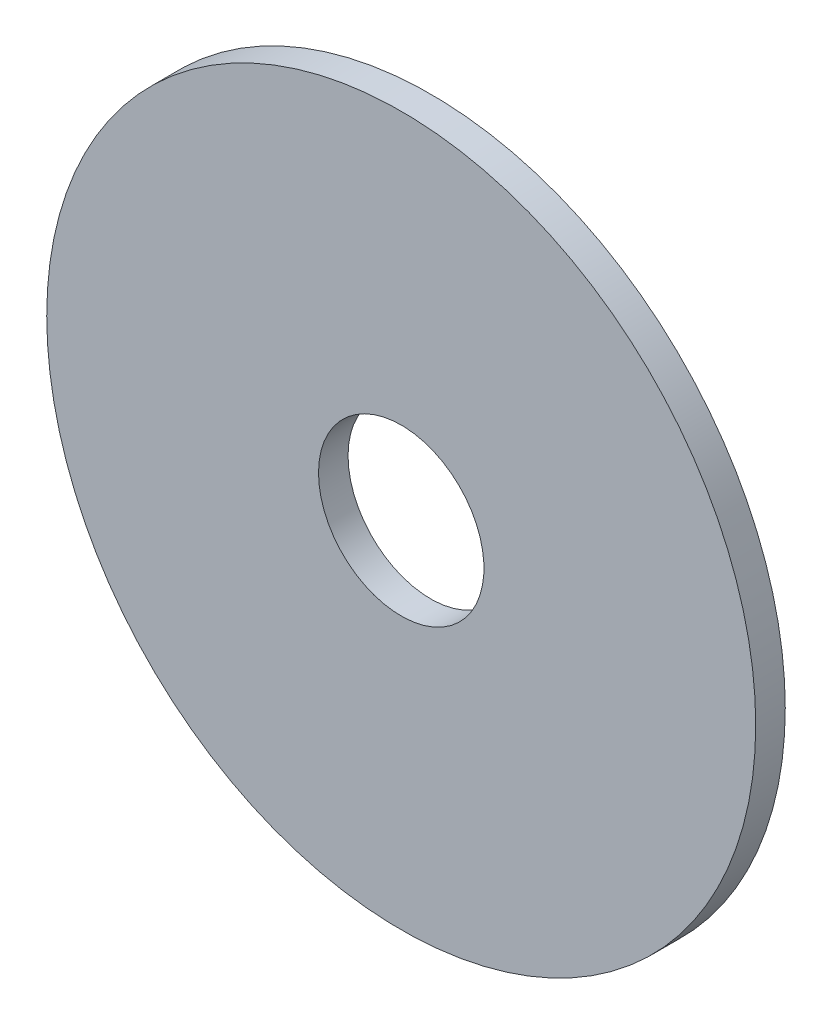
from build123d import *

# Parameters (mm, degrees)
SKETCH1_W = 13.8
SKETCH1_H = 1.5


with BuildPart() as part:
    # Sketch1 → Revolve1 (revolve)
    with BuildSketch(Plane.XZ, mode=Mode.PRIVATE) as revolve1_sk:
        with Locations((11.1, 0.75)):
            Rectangle(SKETCH1_W, SKETCH1_H)
    revolve(revolve1_sk.sketch.rotate(Axis((0, 0, 1.5), (0, 0, -1)), 180), axis=Axis((0, 0, 1.5), (0, 0, -1)))


solid = part.part
